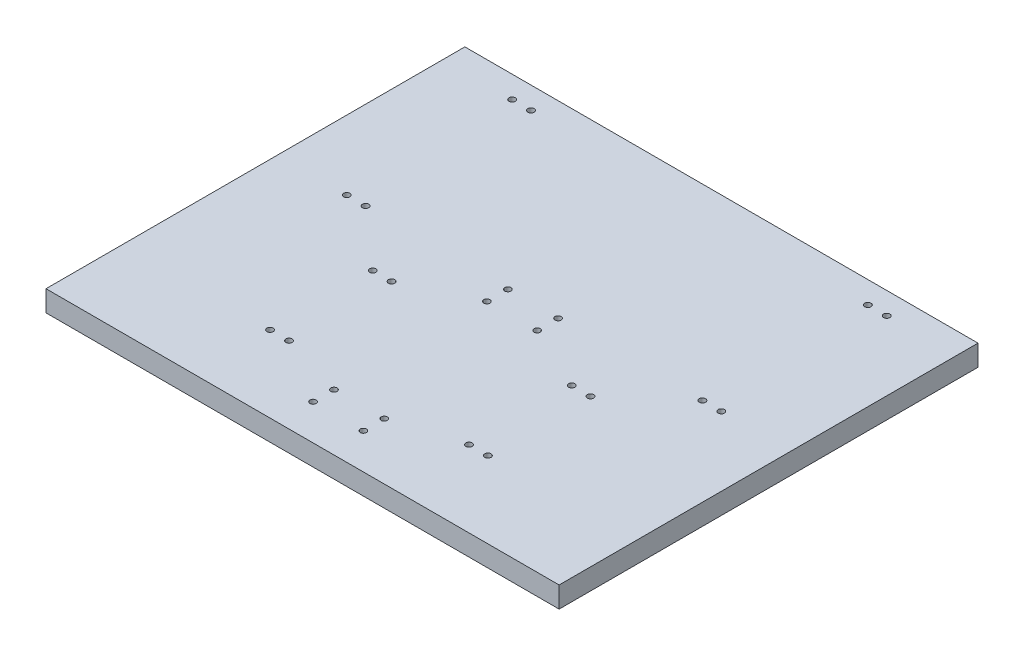
from build123d import *

# Parameters (mm, degrees)
SKETCH1_W           = 122.5
SKETCH1_H           = 200
BOSS_EXTRUDE1_DEPTH = 10
SKETCH4_R           = 1.5
CUT_EXTRUDE2_DEPTH  = 10
SKETCH5_R           = 1.475
CUT_EXTRUDE3_DEPTH  = 10


with BuildPart() as part:
    # Sketch1 → Boss-Extrude1 (new body)
    with BuildSketch(Plane(origin=(0, 0, 0), x_dir=(1, 0, 0), z_dir=(0, 1, 0))):
        with Locations((61.25, 100)):
            Rectangle(SKETCH1_W, SKETCH1_H)
    extrude(amount=BOSS_EXTRUDE1_DEPTH)

    # Sketch4 → Cut-Extrude2 (cut)
    with BuildSketch(Plane(origin=(0, 10, 0), x_dir=(1, 0, 0), z_dir=(0, 1, 0))):
        with Locations(Location((33.075, 189.5, 0), (0, 0, 270))):
            Circle(SKETCH4_R)
        with Locations(Location((42.075, 189.5, 0), (0, 0, 270))):
            Circle(SKETCH4_R)
        with Locations(Location((33.075, 110.5, 0), (0, 0, 270))):
            Circle(SKETCH4_R)
        with Locations(Location((42.075, 110.5, 0), (0, 0, 270))):
            Circle(SKETCH4_R)
        with Locations(Location((70.5, 85.5, 0), (0, 0, 270))):
            Circle(SKETCH4_R)
        with Locations(Location((79.5, 85.5, 0), (0, 0, 270))):
            Circle(SKETCH4_R)
        with Locations(Location((70.5, 36.5, 0), (0, 0, 270))):
            Circle(SKETCH4_R)
        with Locations(Location((79.5, 36.5, 0), (0, 0, 270))):
            Circle(SKETCH4_R)
    extrude(amount=-CUT_EXTRUDE2_DEPTH, mode=Mode.SUBTRACT)

    # Mirror1: part across plane


with BuildPart() as part_1:
    add(part.part)
    add(part.part.mirror(Plane(origin=(122.5, 10, 0), x_dir=(0, 0, 1), z_dir=(-1, 0, 0))))

    # Sketch5 → Cut-Extrude3 (cut)
    with BuildSketch(Plane(origin=(0, 10, 0), x_dir=(1, 0, 0), z_dir=(0, 1, 0))):
        with Locations(Location((134.5, 110, 0), (0, 0, 270))):
            Circle(SKETCH5_R)
        with Locations(Location((110.5, 110, 0), (0, 0, 270))):
            Circle(SKETCH5_R)
        with Locations(Location((110.5, 100, 0), (0, 0, 270))):
            Circle(SKETCH5_R)
        with Locations(Location((134.5, 100, 0), (0, 0, 270))):
            Circle(SKETCH5_R)
        with Locations(Location((110.5, 27, 0), (0, 0, 270))):
            Circle(SKETCH5_R)
        with Locations(Location((134.5, 27, 0), (0, 0, 270))):
            Circle(SKETCH5_R)
        with Locations(Location((134.5, 17, 0), (0, 0, 270))):
            Circle(SKETCH5_R)
        with Locations(Location((110.5, 17, 0), (0, 0, 270))):
            Circle(SKETCH5_R)
    extrude(amount=-CUT_EXTRUDE3_DEPTH, mode=Mode.SUBTRACT)


solid = part_1.part
